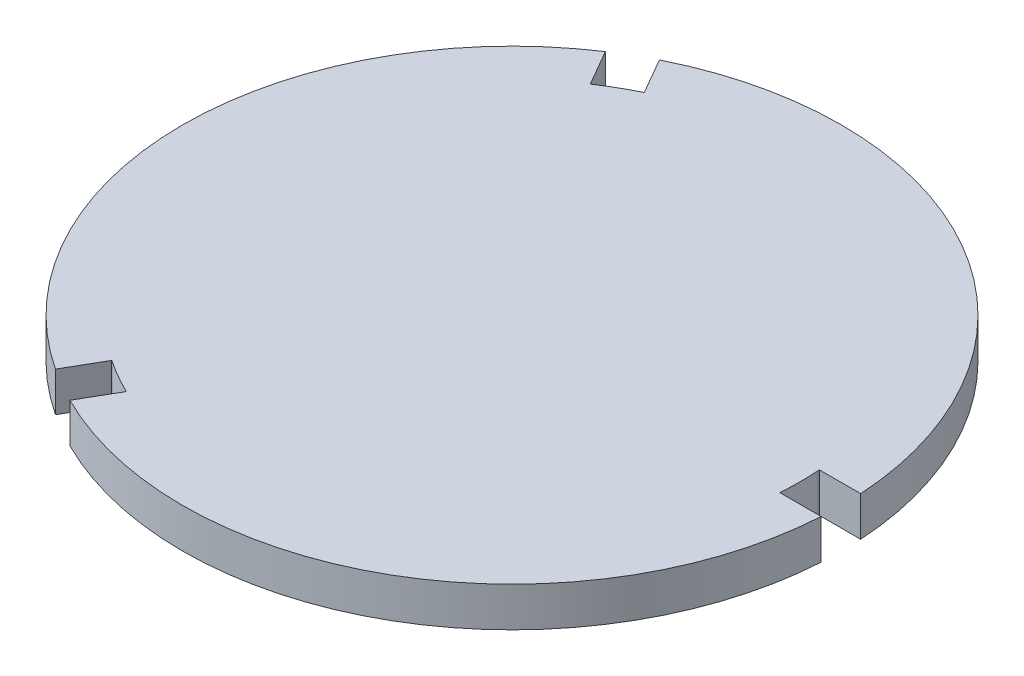
from build123d import *

# Parameters (mm, degrees)
SKETCH1_W           = 88.9
SKETCH1_H           = 12.192
BOSS_EXTRUDE1_DEPTH = 12.192


with BuildPart() as part:
    # Sketch1 → Revolve1 (revolve)
    with BuildSketch(Plane.XY, mode=Mode.PRIVATE) as revolve1_sk:
        with Locations((44.45, -142.376222222)):
            Rectangle(SKETCH1_W, SKETCH1_H)
    revolve(revolve1_sk.sketch.rotate(Axis((0, 0, 0), (0, -1, 0)), 180), axis=Axis((0, 0, 0), (0, -1, 0)))

    # Sketch2 → Boss-Extrude1 (add)
    with BuildSketch(Plane(origin=(0, -136.280222222, 0), x_dir=(1, 0, 0), z_dir=(0, 1, 0))):
        with BuildLine():
            Line((101.416955111, 6.096), (88.716955111, 6.096))
            Line((88.716955111, 6.096), (88.716955111, -6.096))
            Line((88.716955111, -6.096), (101.416955111, -6.096))
            ThreePointArc((101.416955111, -6.096), (50.8, -87.988181024), (-45.429186694, -90.877659501))
            Line((-45.429186694, -90.877659501), (-39.079186694, -79.879136873))
            Line((-39.079186694, -79.879136873), (-49.637768417, -73.783136873))
            Line((-49.637768417, -73.783136873), (-55.987768417, -84.781659501))
            ThreePointArc((-55.987768417, -84.781659501), (-101.6, 0), (-55.987768417, 84.781659501))
            Line((-55.987768417, 84.781659501), (-49.637768417, 73.783136873))
            Line((-49.637768417, 73.783136873), (-39.079186694, 79.879136873))
            Line((-39.079186694, 79.879136873), (-45.429186694, 90.877659501))
            ThreePointArc((-45.429186694, 90.877659501), (50.8, 87.988181024), (101.416955111, 6.096))
        make_face()
    extrude(amount=-BOSS_EXTRUDE1_DEPTH)


solid = part.part
